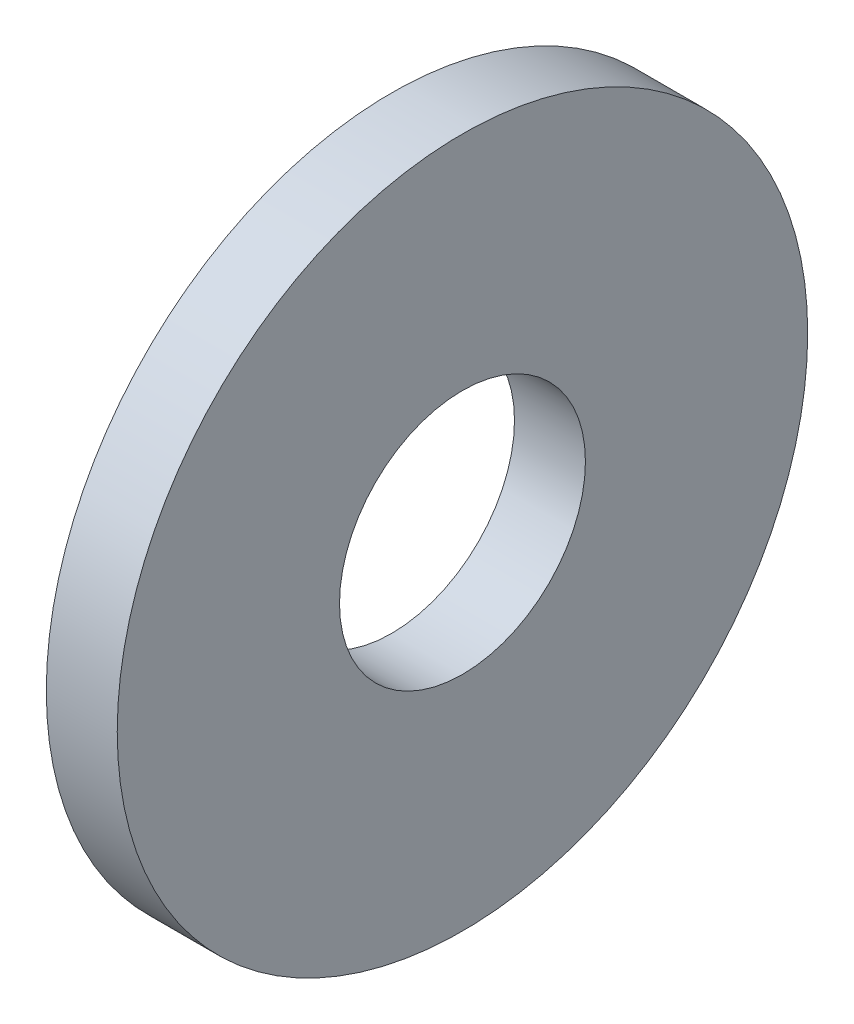
from build123d import *

# Parameters (mm, degrees)
SKETCH1_R           = 5.5626
SKETCH1_R_2         = 1.9812
BOSS_EXTRUDE1_DEPTH = 1.143


with BuildPart() as part:
    # Sketch1 → Boss-Extrude1 (new body)
    with BuildSketch(Plane(origin=(0, 0, 0), x_dir=(0, 0, -1), z_dir=(1, 0, 0))):
        Circle(SKETCH1_R)
        Circle(SKETCH1_R_2, mode=Mode.SUBTRACT)
    extrude(amount=BOSS_EXTRUDE1_DEPTH)


solid = part.part
